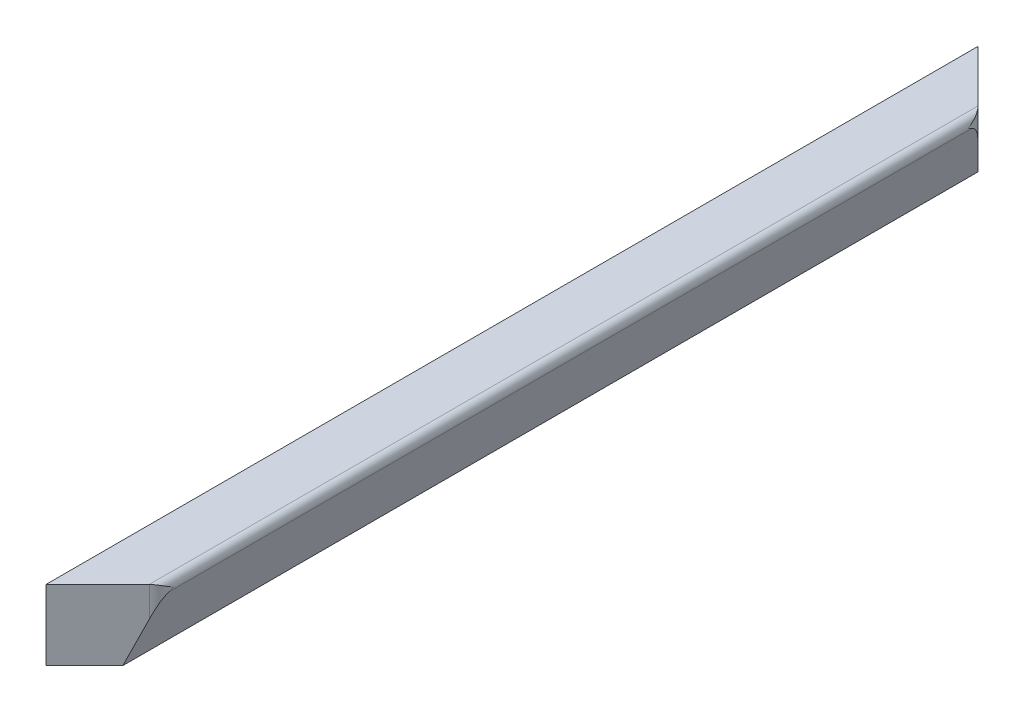
from build123d import *

# Parameters (mm, degrees)
SALIENTE_EXTRUIR1_DEPTH = 38.82833835
CORTAR_EXTRUIR1_REACH   = 48.246


with BuildPart() as part:
    # Croquis1 → Saliente-Extruir1 (new body)
    with BuildSketch(Plane.XY):
        with BuildLine():
            Line((-24.95, 2.065865337), (-24.95, 4.995865337))
            Line((-24.95, 4.995865337), (-22.8, 4.995865337))
            ThreePointArc((-22.8, 4.995865337), (-22.55695313, 4.871729543), (-22.515045035, 4.602053463))
            Line((-22.515045035, 4.602053463), (-23.35, 2.065865337))
            Line((-23.35, 2.065865337), (-24.95, 2.065865337))
        make_face()
    extrude(amount=-SALIENTE_EXTRUIR1_DEPTH)

    # Cortar-Extruir1: up to this face of the body (flat: up to its plane)
    cortar_extruir1_end = Plane(part.part.faces().sort_by_distance((-24.15, 2.065865337, -19.414169175))[0])
    # Croquis3 → Cortar-Extruir1 (cut, up to the picked face)
    with BuildSketch(Plane(origin=(0, 4.995865337, 0), x_dir=(1, 0, 0), z_dir=(0, 1, 0)), mode=Mode.PRIVATE) as cortar_extruir1_sk1:
        with BuildLine():
            Line((-24.95, 38.82833835), (-22.792893219, 36.671231569))
            ThreePointArc((-22.792893219, 36.671231569), (-22.576120467, 36.34680822), (-22.5, 35.964124788))
            Line((-22.5, 35.964124788), (-22.5, 2.864213562))
            ThreePointArc((-22.5, 2.864213562), (-22.576120467, 2.48153013), (-22.792893219, 2.157106781))
            Line((-22.792893219, 2.157106781), (-24.95, 0))
            Line((-24.95, 0), (-24.95, -1.353882683))
            Line((-24.95, -1.353882683), (-20.676224188, -1.353882683))
            Line((-20.676224188, -1.353882683), (-20.676224188, 40.362201109))
            Line((-20.676224188, 40.362201109), (-24.95, 40.362201109))
            Line((-24.95, 40.362201109), (-24.95, 38.82833835))
        make_face()
    cortar_extruir1_tool1 = split(extrude(cortar_extruir1_sk1.sketch, amount=-CORTAR_EXTRUIR1_REACH, mode=Mode.PRIVATE), bisect_by=cortar_extruir1_end, keep=Keep.BOTH, mode=Mode.PRIVATE)
    add(cortar_extruir1_tool1.solids().sort_by(Axis((-21.874385, 4.995865, -19.594031), (0, -1, 0)))[0], mode=Mode.SUBTRACT)


solid = part.part
